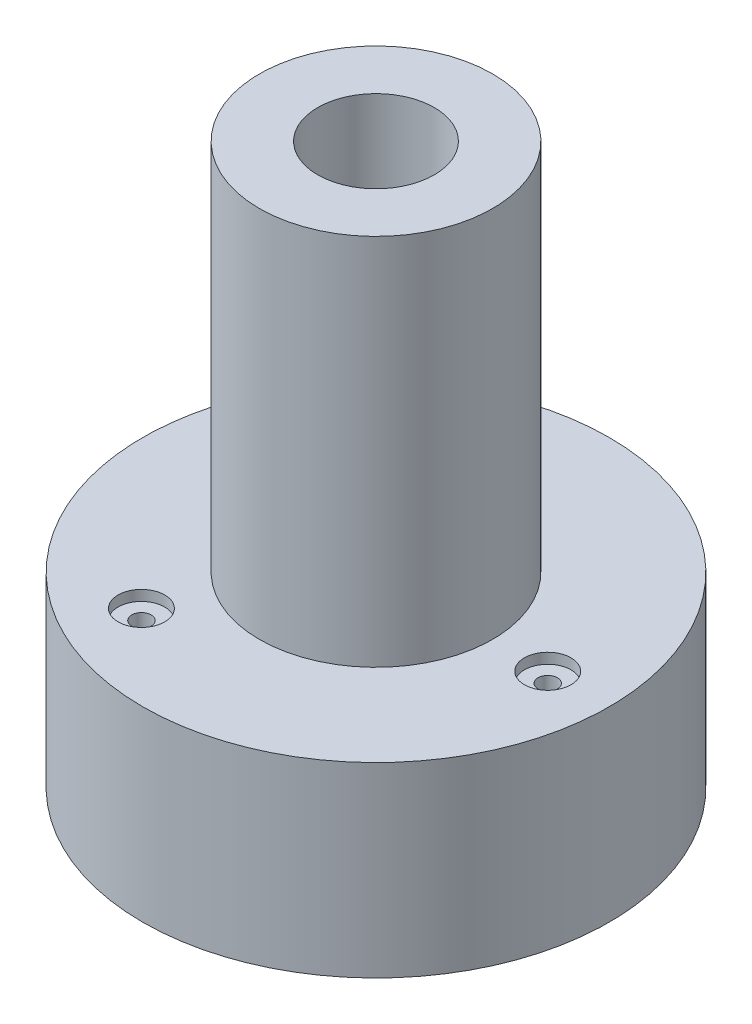
from build123d import *

# Parameters (mm, degrees)
SKETCH1_R                                           = 7.9375
BOSS_EXTRUDE1_DEPTH                                 = 25.4
SKETCH2_R                                           = 15.875
BOSS_EXTRUDE2_DEPTH                                 = 12.7
SKETCH3_R                                           = 3.96875
CUT_EXTRUDE1_DEPTH                                  = 19.05
CBORE_FOR_00_BINDING_HEAD_MACHINE_SCREW_D           = 1.3208
CBORE_FOR_00_BINDING_HEAD_MACHINE_SCREW_CBORE_D     = 3.175
CBORE_FOR_00_BINDING_HEAD_MACHINE_SCREW_CBORE_DEPTH = 0.7112
CIRPATTERN1_COUNT                                   = 3


with BuildPart() as part:
    # Sketch1 → Boss-Extrude1 (new body)
    with BuildSketch(Plane(origin=(0, 0, 0), x_dir=(1, 0, 0), z_dir=(0, 1, 0))):
        with Locations(Location((0, 0, 0), (0, 0, 270))):
            Circle(SKETCH1_R)
    extrude(amount=BOSS_EXTRUDE1_DEPTH)

    # Sketch2 → Boss-Extrude2 (add)
    with BuildSketch(Plane(origin=(0, 0, 0), x_dir=(-1, 0, 0), z_dir=(0, -1, 0))):
        with Locations(Location((0, 0, 0), (0, 0, 90))):
            Circle(SKETCH2_R)
    extrude(amount=BOSS_EXTRUDE2_DEPTH)

    # Sketch3 → Cut-Extrude1 (cut)
    with BuildSketch(Plane(origin=(0, 25.4, 0), x_dir=(1, 0, 0), z_dir=(0, 1, 0))):
        with Locations(Location((0, 0, 0), (0, 0, 270))):
            Circle(SKETCH3_R)
    extrude(amount=-CUT_EXTRUDE1_DEPTH, mode=Mode.SUBTRACT)

    # CBORE for #00 Binding Head Machine Screw1 (through all)
    with Locations(Plane(origin=(0, 0, 0), x_dir=(1, 0, 0), z_dir=(0, 1, 0))):
        with Locations((11.687693986, 0)):
            cbore_for_00_binding_head_machine_screw = CounterBoreHole(CBORE_FOR_00_BINDING_HEAD_MACHINE_SCREW_D / 2, CBORE_FOR_00_BINDING_HEAD_MACHINE_SCREW_CBORE_D / 2, CBORE_FOR_00_BINDING_HEAD_MACHINE_SCREW_CBORE_DEPTH)

    # CirPattern1: CBORE for #00 Binding Head Machine Screw1 ×3 about axis
    cirpattern1_axis = Axis((0, 0, 0), (0, 1, 0))
    for i in range(1, CIRPATTERN1_COUNT):
        add(cbore_for_00_binding_head_machine_screw.rotate(cirpattern1_axis, i * 360 / CIRPATTERN1_COUNT), mode=Mode.SUBTRACT)


solid = part.part
